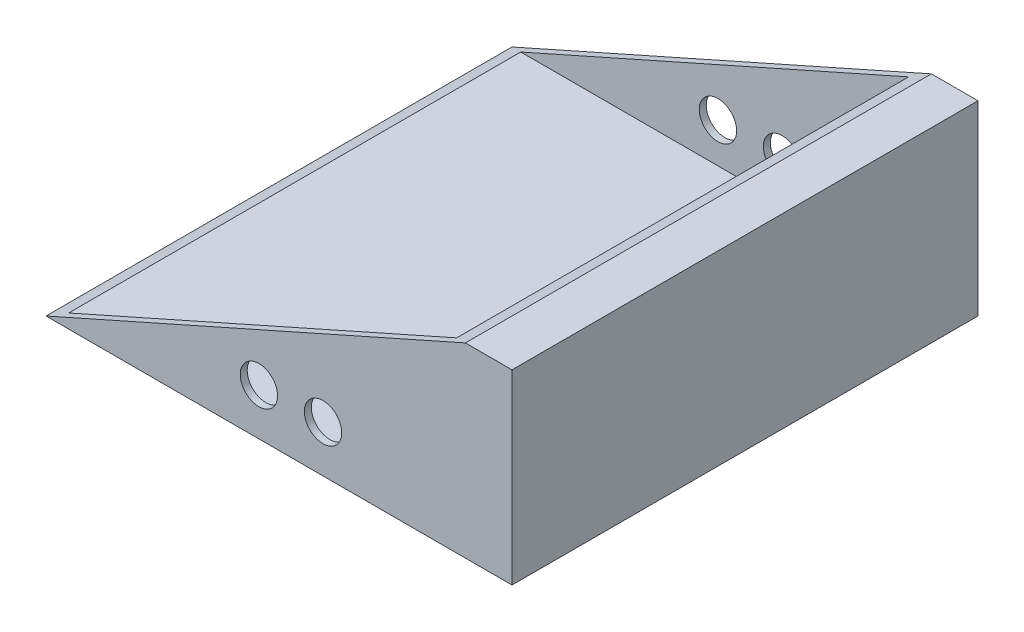
from build123d import *

# Parameters (mm, degrees)
BOSS_EXTRUDE4_DEPTH = 200
SHELL2_T            = -3
SKETCH4_R           = 8.02
BOSS_EXTRUDE5_DEPTH = 3
SKETCH4_7_R         = 8.02
CUT_EXTRUDE1_DEPTH  = 4
CUT_EXTRUDE2_START  = 4
SKETCH5_R           = 8.02
CUT_EXTRUDE2_DEPTH  = 4


with BuildPart() as part:
    # Sketch1 → Boss-Extrude4 (new body)
    with BuildSketch(Plane.XY):
        Polygon((0, 0), (200, 0), (200, 80), (180, 80), align=None)
    extrude(amount=BOSS_EXTRUDE4_DEPTH)

    # Shell2
    shell2_openings = [part.faces().sort_by_distance(p)[0] for p in [
        (90, 40, 100),
    ]]
    offset(amount=SHELL2_T, openings=shell2_openings, kind=Kind.INTERSECTION)

    # Sketch4 → Boss-Extrude5 (add)
    with BuildSketch(Plane.XY.offset(200)):
        with Locations((91.379034553, 20)):
            Circle(SKETCH4_R)
        with Locations((118.899034553, 20)):
            Circle(SKETCH4_R)
    extrude(amount=-BOSS_EXTRUDE5_DEPTH)

    # Sketch4<7> → Cut-Extrude1 (cut)
    with BuildSketch(Plane.XY.offset(200)):
        with Locations((91.379034553, 20)):
            Circle(SKETCH4_7_R)
        with Locations((118.899034553, 20)):
            Circle(SKETCH4_7_R)
    extrude(amount=-CUT_EXTRUDE1_DEPTH, mode=Mode.SUBTRACT)

    # Sketch5 → Cut-Extrude2 (cut)
    with BuildSketch(Plane.XY.offset(CUT_EXTRUDE2_START)):
        with Locations((91.379034553, 20)):
            Circle(SKETCH5_R)
        with Locations((118.899034553, 20)):
            Circle(SKETCH5_R)
    extrude(amount=-CUT_EXTRUDE2_DEPTH, mode=Mode.SUBTRACT)


solid = part.part
